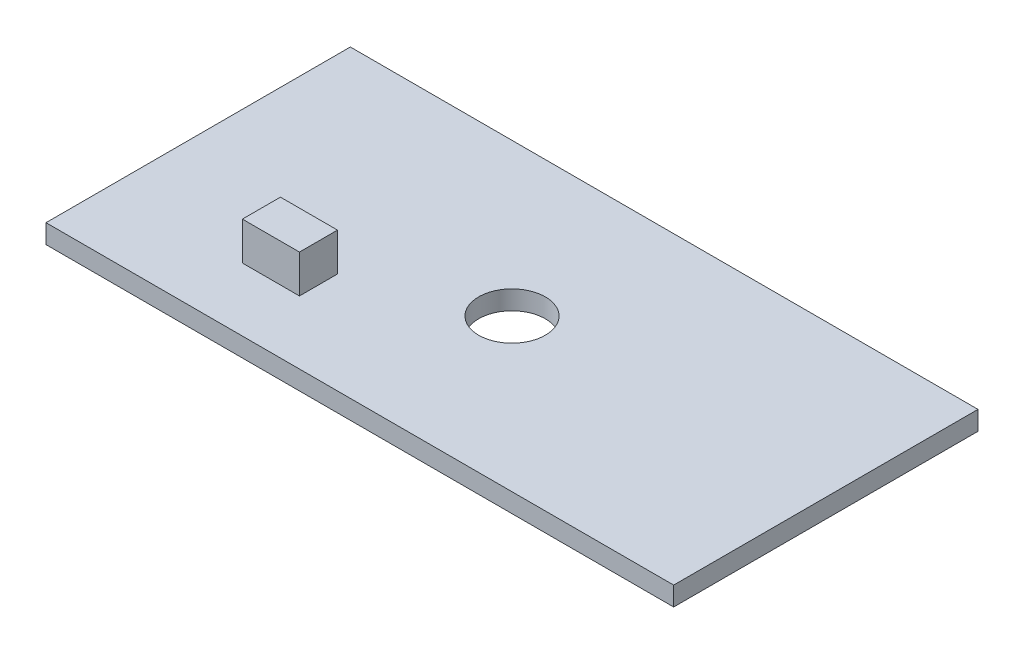
from build123d import *

# Parameters (mm, degrees)
SKETCH_1_W      = 33
SKETCH_1_H      = 16
SKETCH_1_R      = 1.75
EXTRUDE_1_DEPTH = 1
SKETCH_2_W      = 3
SKETCH_2_H      = 2
EXTRUDE_2_DEPTH = 3


with BuildPart() as part:
    # Эскиз1 → Бобышка-Вытянуть1 (new body)
    with BuildSketch(Plane(origin=(0, 0, 0), x_dir=(1, 0, 0), z_dir=(0, 1, 0))):
        with Locations((-16.5, 0)):
            Rectangle(SKETCH_1_W, SKETCH_1_H)
        with Locations(Location((-16.5, 0, 0), (0, 0, 270))):
            Circle(SKETCH_1_R, mode=Mode.SUBTRACT)
    extrude(amount=EXTRUDE_1_DEPTH)

    # Эскиз2 → Бобышка-Вытянуть2 (add)
    with BuildSketch(Plane(origin=(0, 0, 0), x_dir=(1, 0, 0), z_dir=(0, 1, 0))):
        with Locations((-24.5, -3.674415698)):
            Rectangle(SKETCH_2_W, SKETCH_2_H)
    extrude(amount=EXTRUDE_2_DEPTH)


solid = part.part
